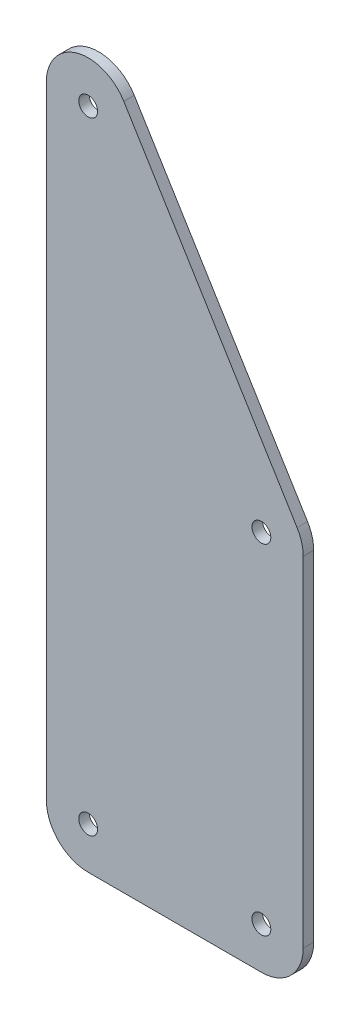
from build123d import *

# Parameters (mm, degrees)
EXTRUDE_1_DEPTH     = 10
SKETCH_2_R          = 9
CUT_EXTRUDE_1_DEPTH = 20
SCALE_1_SCALE       = 0.8


with BuildPart() as part:
    # 草图1 → 凸台-拉伸1 (new body)
    with BuildSketch(Plane.XY):
        with BuildLine():
            Line((40, 0), (205.6, 0))
            ThreePointArc((205.6, 0), (233.884271247, 11.715728753), (245.6, 40))
            Line((245.6, 40), (245.6, 364.360360803))
            ThreePointArc((245.6, 364.360360803), (244.096078512, 375.225531726), (239.697403041, 385.273684447))
            Line((239.697403041, 385.273684447), (74.097403041, 655.270459692))
            ThreePointArc((74.097403041, 655.270459692), (29.134829077, 672.85321456), (0, 634.357136047))
            Line((0, 634.357136047), (0, 40))
            ThreePointArc((0, 40), (11.715728753, 11.715728753), (40, 0))
        make_face()
    extrude(amount=EXTRUDE_1_DEPTH)

    # 草图2 → 切除-拉伸1 (cut)
    with BuildSketch(Plane(origin=(0, 0, 0), x_dir=(-1, 0, 0), z_dir=(0, 0, -1))):
        with Locations((-40, 634.357136047)):
            Circle(SKETCH_2_R)
        with Locations((-205.6, 364.360360803)):
            Circle(SKETCH_2_R)
        with Locations((-40, 40)):
            Circle(SKETCH_2_R)
        with Locations((-205.6, 40)):
            Circle(SKETCH_2_R)
    extrude(amount=-CUT_EXTRUDE_1_DEPTH, mode=Mode.SUBTRACT)


with BuildPart() as part_1:
    # 缩放比例1: scaled about (0, 0, 0)
    add(part.part.scale(SCALE_1_SCALE))


solid = part_1.part
